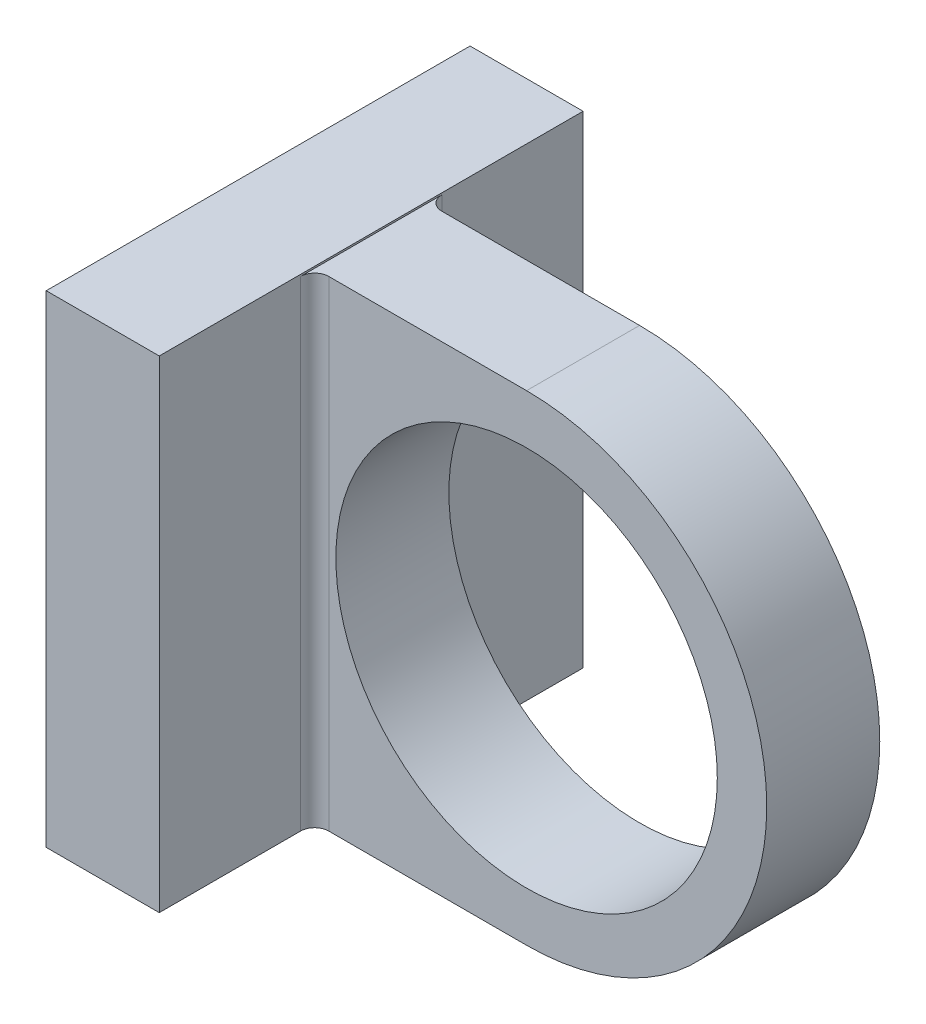
from build123d import *

# Parameters (mm, degrees)
SKETCH2_R           = 13.5
BOSS_EXTRUDE1_DEPTH = 8
SKETCH3_W           = 30
SKETCH3_H           = 34.126910457
BOSS_EXTRUDE2_DEPTH = 8
FILLET1_R           = 1


with BuildPart() as part:
    # Sketch2 → Boss-Extrude1 (new body)
    with BuildSketch(Plane.XY):
        with BuildLine():
            Line((22.912878475, 16.112283523), (-0.087121525, 16.112283523))
            Line((-0.087121525, 16.112283523), (-0.087121525, -17.887716477))
            Line((-0.087121525, -17.887716477), (22.912878475, -17.887716477))
            ThreePointArc((22.912878475, -17.887716477), (39.912878475, -0.887716477), (22.912878475, 16.112283523))
        make_face()
        with Locations((22.912878475, -0.887716477)):
            Circle(SKETCH2_R, mode=Mode.SUBTRACT)
    extrude(amount=BOSS_EXTRUDE1_DEPTH)

    # Sketch3 → Boss-Extrude2 (add)
    with BuildSketch(Plane.ZY.offset(0.087121525)):
        with Locations((4, -0.824261249)):
            Rectangle(SKETCH3_W, SKETCH3_H)
    extrude(amount=-BOSS_EXTRUDE2_DEPTH)

    # Fillet1
    fillet1_edges = [part.edges().sort_by_distance(p)[0] for p in [
        (7.912878475, -0.887716477, 8),
        (7.912878475, -0.887716477, 0),
    ]]
    fillet(fillet1_edges, radius=FILLET1_R)


solid = part.part
